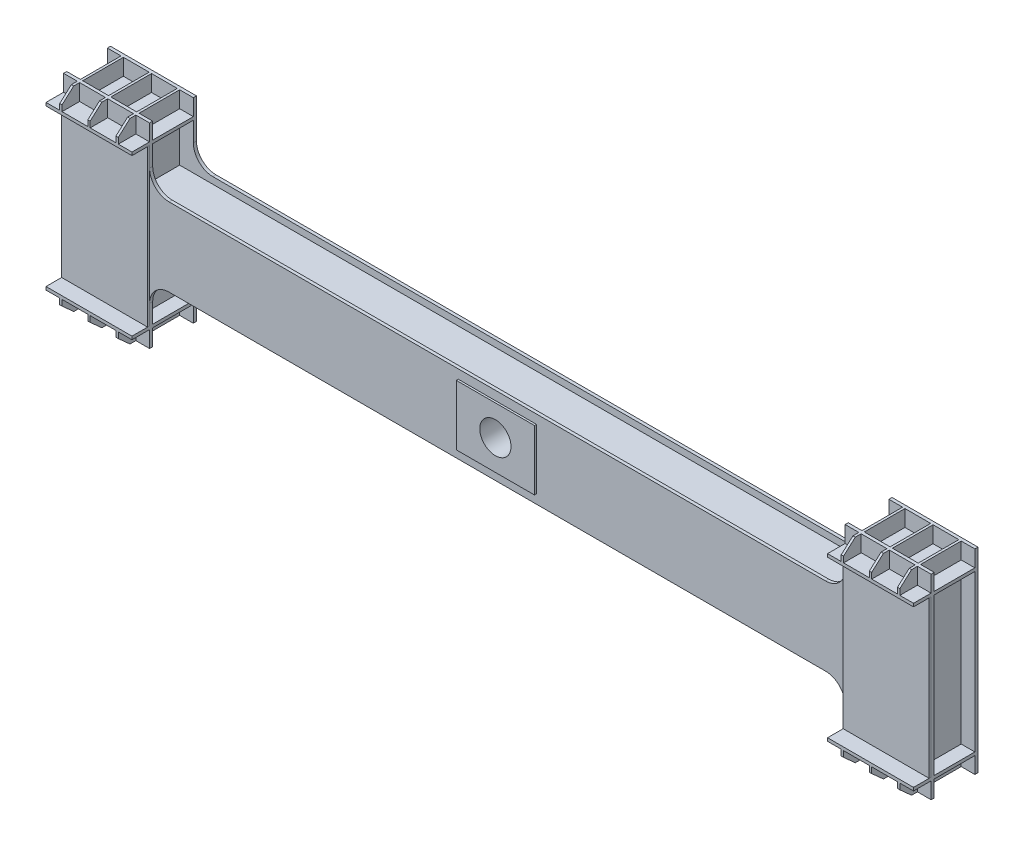
from build123d import *

# Parameters (mm, degrees)
SKETCH_1_W                       = 2220
SKETCH_1_H                       = 500
EXTRUDE_1_DEPTH                  = 120
SKETCH_2_W                       = 1780
SKETCH_2_H                       = 150
CUT_EXTRUDE_1_DEPTH              = 2279.77159891
SKETCH_3_W                       = 200
SKETCH_3_H                       = 154
EXTRUDE_2_DEPTH                  = 8
SKETCH_4_R                       = 40
CUT_EXTRUDE_2_DEPTH              = 2280.206879596
SKETCH_5_W                       = 220
SKETCH_5_H                       = 416
EXTRUDE_3_DEPTH                  = 45
SKETCH_6_W                       = 40
SKETCH_6_H                       = 400
CUT_EXTRUDE_3_DEPTH              = 2282.583879677
SKETCH_7_W                       = 6
SKETCH_7_H                       = 42
EXTRUDE_4_DEPTH                  = 45
CUT_EXTRUDE_4_DEPTH              = 2178.611994824
SKETCH_9_W                       = 6
SKETCH_9_H                       = 42
EXTRUDE_5_DEPTH                  = 45
CUT_EXTRUDE_5_DEPTH              = 2178.611994824
PATTERN_LINEAR_3_COUNT           = 2
PATTERN_LINEAR_3_PITCH           = 72
PATTERN_LINEAR_4_COUNT           = 2
PATTERN_LINEAR_4_PITCH           = 72
SKETCH_13_W                      = 35
SKETCH_13_H                      = 104
SKETCH_13_W_2                    = 66
CUT_EXTRUDE_8_DEPTH              = 42
SKETCH_14_W                      = 35
SKETCH_14_H                      = 104
SKETCH_14_W_2                    = 66
CUT_EXTRUDE_9_DEPTH              = 42
PATTERN_LINEAR_5_COUNT           = 2
PATTERN_LINEAR_5_PITCH           = 2000
PATTERN_LINEAR_5_COPY_1_SKETCH_W = 6
PATTERN_LINEAR_5_COPY_1_SKETCH_H = 42
PATTERN_LINEAR_5_COPY_1_DEPTH    = 45
PATTERN_LINEAR_5_COPY_2_DEPTH    = 2178.611994824
PATTERN_LINEAR_5_COPY_3_SKETCH_W = 6
PATTERN_LINEAR_5_COPY_3_SKETCH_H = 42
PATTERN_LINEAR_5_COPY_3_DEPTH    = 45
PATTERN_LINEAR_5_COPY_4_DEPTH    = 2178.611994824
PATTERN_LINEAR_5_COPY_5_SKETCH_W = 6
PATTERN_LINEAR_5_COPY_5_SKETCH_H = 42
PATTERN_LINEAR_5_COPY_5_DEPTH    = 45
PATTERN_LINEAR_5_COPY_6_DEPTH    = 2178.611994824
PATTERN_LINEAR_5_COPY_7_SKETCH_W = 6
PATTERN_LINEAR_5_COPY_7_SKETCH_H = 42
PATTERN_LINEAR_5_COPY_7_DEPTH    = 45
PATTERN_LINEAR_5_COPY_8_DEPTH    = 2178.611994824
SKETCH_15_W                      = 1780
SKETCH_15_H                      = 104
CUT_EXTRUDE_10_DEPTH             = 17
SKETCH_16_W                      = 1780
SKETCH_16_H                      = 104
CUT_EXTRUDE_11_DEPTH             = 17
SKETCH_18_W                      = 104
SKETCH_18_H                      = 117
CUT_EXTRUDE_13_DEPTH             = 35
SKETCH_19_W                      = 104
SKETCH_19_H                      = 117
CUT_EXTRUDE_14_DEPTH             = 35
SKETCH_20_W                      = 104
SKETCH_20_H                      = 400
CUT_EXTRUDE_15_DEPTH             = 35
SKETCH_21_W                      = 104
SKETCH_21_H                      = 400
CUT_EXTRUDE_16_DEPTH             = 35
SKETCH_22_W                      = 5
SKETCH_22_H                      = 400
CUT_EXTRUDE_17_DEPTH             = 0.0001
SKETCH_23_W                      = 5
SKETCH_23_H                      = 400
CUT_EXTRUDE_18_DEPTH             = 0.0001
SKETCH_24_W                      = 5
SKETCH_24_H                      = 400
CUT_EXTRUDE_19_DEPTH             = 0.0001
SKETCH_25_W                      = 5
SKETCH_25_H                      = 400
CUT_EXTRUDE_20_DEPTH             = 0.0001
FILLET_1_R                       = 50


with BuildPart() as part:
    # 草图1 → 凸台-拉伸1 (new body)
    with BuildSketch(Plane.XY):
        with Locations((1110, 250)):
            Rectangle(SKETCH_1_W, SKETCH_1_H)
    extrude(amount=EXTRUDE_1_DEPTH)

    # 草图2 → 切除-拉伸1 (cut, through all)
    with BuildSketch(Plane.XY.offset(120)):
        with Locations((1110, 425)):
            Rectangle(SKETCH_2_W, SKETCH_2_H)
        with Locations((1110, 75)):
            Rectangle(SKETCH_2_W, SKETCH_2_H)
    extrude(amount=-CUT_EXTRUDE_1_DEPTH, mode=Mode.SUBTRACT)

    # 草图3 → 凸台-拉伸2 (add)
    with BuildSketch(Plane.XY.offset(120)):
        with Locations((1110, 250)):
            Rectangle(SKETCH_3_W, SKETCH_3_H)
    extrude(amount=EXTRUDE_2_DEPTH)

    # 草图4 → 切除-拉伸2 (cut, through all)
    with BuildSketch(Plane.XY.offset(128)):
        with Locations((1110, 250)):
            Circle(SKETCH_4_R)
    extrude(amount=-CUT_EXTRUDE_2_DEPTH, mode=Mode.SUBTRACT)

    # 草图5 → 凸台-拉伸3 (add)
    with BuildSketch(Plane.XY.offset(120)):
        with Locations((110, 250)):
            Rectangle(SKETCH_5_W, SKETCH_5_H)
    extrude_3 = extrude(amount=EXTRUDE_3_DEPTH)

    # 草图6 → 切除-拉伸3 (cut, through all)
    with BuildSketch(Plane.ZY):
        with Locations((145, 250)):
            Rectangle(SKETCH_6_W, SKETCH_6_H)
    cut_extrude_3 = extrude(amount=-CUT_EXTRUDE_3_DEPTH, mode=Mode.SUBTRACT)

    # 草图7 → 凸台-拉伸4 (add)
    with BuildSketch(Plane.XY.offset(120)):
        with Locations((110, 21)):
            Rectangle(SKETCH_7_W, SKETCH_7_H)
    extrude_4 = extrude(amount=EXTRUDE_4_DEPTH)

    # 草图8 → 切除-拉伸4 (cut, through all)
    with BuildSketch(Plane.ZY.offset(-107)):
        Polygon((165, 27), (135, 0), (165, 0), align=None)
    cut_extrude_4 = extrude(amount=-CUT_EXTRUDE_4_DEPTH, mode=Mode.SUBTRACT)

    # 草图9 → 凸台-拉伸5 (add)
    with BuildSketch(Plane.XY.offset(120)):
        with Locations((110, 479)):
            Rectangle(SKETCH_9_W, SKETCH_9_H)
    extrude_5 = extrude(amount=EXTRUDE_5_DEPTH)

    # 草图10 → 切除-拉伸5 (cut, through all)
    with BuildSketch(Plane.ZY.offset(-107)):
        Polygon((165, 500), (135, 500), (165, 473), align=None)
    cut_extrude_5 = extrude(amount=-CUT_EXTRUDE_5_DEPTH, mode=Mode.SUBTRACT)

    # 阵列(线性)3: 凸台-拉伸4, 切除-拉伸4, 凸台-拉伸5, 切除-拉伸5 ×2
    with Locations(*[(i * PATTERN_LINEAR_3_PITCH, 0, 0) for i in range(1, PATTERN_LINEAR_3_COUNT)]):
        add(extrude_4)
        add(cut_extrude_4, mode=Mode.SUBTRACT)
        add(extrude_5)
        add(cut_extrude_5, mode=Mode.SUBTRACT)

    # 阵列(线性)4: 凸台-拉伸4, 切除-拉伸4, 凸台-拉伸5, 切除-拉伸5 ×2
    with Locations(*[(-i * PATTERN_LINEAR_4_PITCH, 0, 0) for i in range(1, PATTERN_LINEAR_4_COUNT)]):
        add(extrude_4)
        add(cut_extrude_4, mode=Mode.SUBTRACT)
        add(extrude_5)
        add(cut_extrude_5, mode=Mode.SUBTRACT)

    # 草图13 → 切除-拉伸8 (cut)
    with BuildSketch(Plane.XZ):
        with Locations((17.5, 60)):
            Rectangle(SKETCH_13_W, SKETCH_13_H)
        with Locations((74, 60)):
            Rectangle(SKETCH_13_W_2, SKETCH_13_H)
        with Locations((146, 60)):
            Rectangle(SKETCH_13_W_2, SKETCH_13_H)
        with Locations((202.5, 60)):
            Rectangle(SKETCH_13_W, SKETCH_13_H)
    cut_extrude_8 = extrude(amount=-CUT_EXTRUDE_8_DEPTH, mode=Mode.SUBTRACT)

    # 草图14 → 切除-拉伸9 (cut)
    with BuildSketch(Plane(origin=(0, 500, 0), x_dir=(1, 0, 0), z_dir=(0, 1, 0))):
        with Locations((17.5, -60)):
            Rectangle(SKETCH_14_W, SKETCH_14_H)
        with Locations((74, -60)):
            Rectangle(SKETCH_14_W_2, SKETCH_14_H)
        with Locations((146, -60)):
            Rectangle(SKETCH_14_W_2, SKETCH_14_H)
        with Locations((202.5, -60)):
            Rectangle(SKETCH_14_W, SKETCH_14_H)
    cut_extrude_9 = extrude(amount=-CUT_EXTRUDE_9_DEPTH, mode=Mode.SUBTRACT)

    # 阵列(线性)5: 凸台-拉伸3, 切除-拉伸3, 凸台-拉伸4, 切除-拉伸4, 凸台-拉伸5, 切除-拉伸5, 切除-拉伸8, 切除-拉伸9 ×2
    with Locations(*[(i * PATTERN_LINEAR_5_PITCH, 0, 0) for i in range(1, PATTERN_LINEAR_5_COUNT)]):
        add(extrude_3)
        add(cut_extrude_3, mode=Mode.SUBTRACT)
        add(extrude_4)
        add(cut_extrude_4, mode=Mode.SUBTRACT)
        add(extrude_5)
        add(cut_extrude_5, mode=Mode.SUBTRACT)
        add(cut_extrude_8, mode=Mode.SUBTRACT)
        add(cut_extrude_9, mode=Mode.SUBTRACT)

    # 阵列(线性)5 copy 1 sketch → 阵列(线性)5 copy 1 (add)
    with BuildSketch(Plane(origin=(2072, 0, 120), x_dir=(1, 0, 0), z_dir=(0, 0, 1))):
        with Locations((110, 21)):
            Rectangle(PATTERN_LINEAR_5_COPY_1_SKETCH_W, PATTERN_LINEAR_5_COPY_1_SKETCH_H)
    extrude(amount=PATTERN_LINEAR_5_COPY_1_DEPTH)

    # 阵列(线性)5 copy 2 sketch → 阵列(线性)5 copy 2 (cut, through all)
    with BuildSketch(Plane.ZY.offset(-2179)):
        Polygon((165, 27), (135, 0), (165, 0), align=None)
    extrude(amount=-PATTERN_LINEAR_5_COPY_2_DEPTH, mode=Mode.SUBTRACT)

    # 阵列(线性)5 copy 3 sketch → 阵列(线性)5 copy 3 (add)
    with BuildSketch(Plane(origin=(2072, 0, 120), x_dir=(1, 0, 0), z_dir=(0, 0, 1))):
        with Locations((110, 479)):
            Rectangle(PATTERN_LINEAR_5_COPY_3_SKETCH_W, PATTERN_LINEAR_5_COPY_3_SKETCH_H)
    extrude(amount=PATTERN_LINEAR_5_COPY_3_DEPTH)

    # 阵列(线性)5 copy 4 sketch → 阵列(线性)5 copy 4 (cut, through all)
    with BuildSketch(Plane.ZY.offset(-2179)):
        Polygon((165, 500), (135, 500), (165, 473), align=None)
    extrude(amount=-PATTERN_LINEAR_5_COPY_4_DEPTH, mode=Mode.SUBTRACT)

    # 阵列(线性)5 copy 5 sketch → 阵列(线性)5 copy 5 (add)
    with BuildSketch(Plane(origin=(1928, 0, 120), x_dir=(1, 0, 0), z_dir=(0, 0, 1))):
        with Locations((110, 21)):
            Rectangle(PATTERN_LINEAR_5_COPY_5_SKETCH_W, PATTERN_LINEAR_5_COPY_5_SKETCH_H)
    extrude(amount=PATTERN_LINEAR_5_COPY_5_DEPTH)

    # 阵列(线性)5 copy 6 sketch → 阵列(线性)5 copy 6 (cut, through all)
    with BuildSketch(Plane.ZY.offset(-2035)):
        Polygon((165, 27), (135, 0), (165, 0), align=None)
    extrude(amount=-PATTERN_LINEAR_5_COPY_6_DEPTH, mode=Mode.SUBTRACT)

    # 阵列(线性)5 copy 7 sketch → 阵列(线性)5 copy 7 (add)
    with BuildSketch(Plane(origin=(1928, 0, 120), x_dir=(1, 0, 0), z_dir=(0, 0, 1))):
        with Locations((110, 479)):
            Rectangle(PATTERN_LINEAR_5_COPY_7_SKETCH_W, PATTERN_LINEAR_5_COPY_7_SKETCH_H)
    extrude(amount=PATTERN_LINEAR_5_COPY_7_DEPTH)

    # 阵列(线性)5 copy 8 sketch → 阵列(线性)5 copy 8 (cut, through all)
    with BuildSketch(Plane.ZY.offset(-2035)):
        Polygon((165, 500), (135, 500), (165, 473), align=None)
    extrude(amount=-PATTERN_LINEAR_5_COPY_8_DEPTH, mode=Mode.SUBTRACT)

    # 草图15 → 切除-拉伸10 (cut)
    with BuildSketch(Plane(origin=(0, 350, 0), x_dir=(1, 0, 0), z_dir=(0, 1, 0))):
        with Locations((1110, -60)):
            Rectangle(SKETCH_15_W, SKETCH_15_H)
    extrude(amount=-CUT_EXTRUDE_10_DEPTH, mode=Mode.SUBTRACT)

    # 草图16 → 切除-拉伸11 (cut)
    with BuildSketch(Plane.XZ.offset(-150)):
        with Locations((1110, 60)):
            Rectangle(SKETCH_16_W, SKETCH_16_H)
    extrude(amount=-CUT_EXTRUDE_11_DEPTH, mode=Mode.SUBTRACT)

    # 草图18 → 切除-拉伸13 (cut)
    with BuildSketch(Plane(origin=(220, 0, 0), x_dir=(0, 0, -1), z_dir=(1, 0, 0))):
        with Locations((-60, 108.5)):
            Rectangle(SKETCH_18_W, SKETCH_18_H)
        with Locations((-60, 391.5)):
            Rectangle(SKETCH_18_W, SKETCH_18_H)
    extrude(amount=-CUT_EXTRUDE_13_DEPTH, mode=Mode.SUBTRACT)

    # 草图19 → 切除-拉伸14 (cut)
    with BuildSketch(Plane.ZY.offset(-2000)):
        with Locations((60, 108.5)):
            Rectangle(SKETCH_19_W, SKETCH_19_H)
        with Locations((60, 391.5)):
            Rectangle(SKETCH_19_W, SKETCH_19_H)
    extrude(amount=-CUT_EXTRUDE_14_DEPTH, mode=Mode.SUBTRACT)

    # 草图20 → 切除-拉伸15 (cut)
    with BuildSketch(Plane(origin=(2220, 0, 0), x_dir=(0, 0, -1), z_dir=(1, 0, 0))):
        with Locations((-60, 250)):
            Rectangle(SKETCH_20_W, SKETCH_20_H)
    extrude(amount=-CUT_EXTRUDE_15_DEPTH, mode=Mode.SUBTRACT)

    # 草图21 → 切除-拉伸16 (cut)
    with BuildSketch(Plane.ZY):
        with Locations((60, 250)):
            Rectangle(SKETCH_21_W, SKETCH_21_H)
    extrude(amount=-CUT_EXTRUDE_16_DEPTH, mode=Mode.SUBTRACT)

    # 草图22 → 切除-拉伸17 (cut)
    with BuildSketch(Plane.ZY):
        with Locations((122.5, 250)):
            Rectangle(SKETCH_22_W, SKETCH_22_H)
    extrude(amount=-CUT_EXTRUDE_17_DEPTH, mode=Mode.SUBTRACT)

    # 草图23 → 切除-拉伸18 (cut)
    with BuildSketch(Plane(origin=(220, 0, 0), x_dir=(0, 0, -1), z_dir=(1, 0, 0))):
        with Locations((-122.5, 250)):
            Rectangle(SKETCH_23_W, SKETCH_23_H)
    extrude(amount=-CUT_EXTRUDE_18_DEPTH, mode=Mode.SUBTRACT)

    # 草图24 → 切除-拉伸19 (cut)
    with BuildSketch(Plane.ZY.offset(-2000)):
        with Locations((122.5, 250)):
            Rectangle(SKETCH_24_W, SKETCH_24_H)
    extrude(amount=-CUT_EXTRUDE_19_DEPTH, mode=Mode.SUBTRACT)

    # 草图25 → 切除-拉伸20 (cut)
    with BuildSketch(Plane(origin=(2220, 0, 0), x_dir=(0, 0, -1), z_dir=(1, 0, 0))):
        with Locations((-122.5, 250)):
            Rectangle(SKETCH_25_W, SKETCH_25_H)
    extrude(amount=-CUT_EXTRUDE_20_DEPTH, mode=Mode.SUBTRACT)

    # 圆角1
    fillet_1_edges = [part.edges().sort_by_distance(p)[0] for p in [
        (220, 350, 116),
        (220, 350, 4),
        (220, 150, 4),
        (220, 150, 116),
        (2000, 150, 4),
        (2000, 150, 116),
        (2000, 350, 4),
        (2000, 350, 116),
    ]]
    fillet(fillet_1_edges, radius=FILLET_1_R)


solid = part.part
